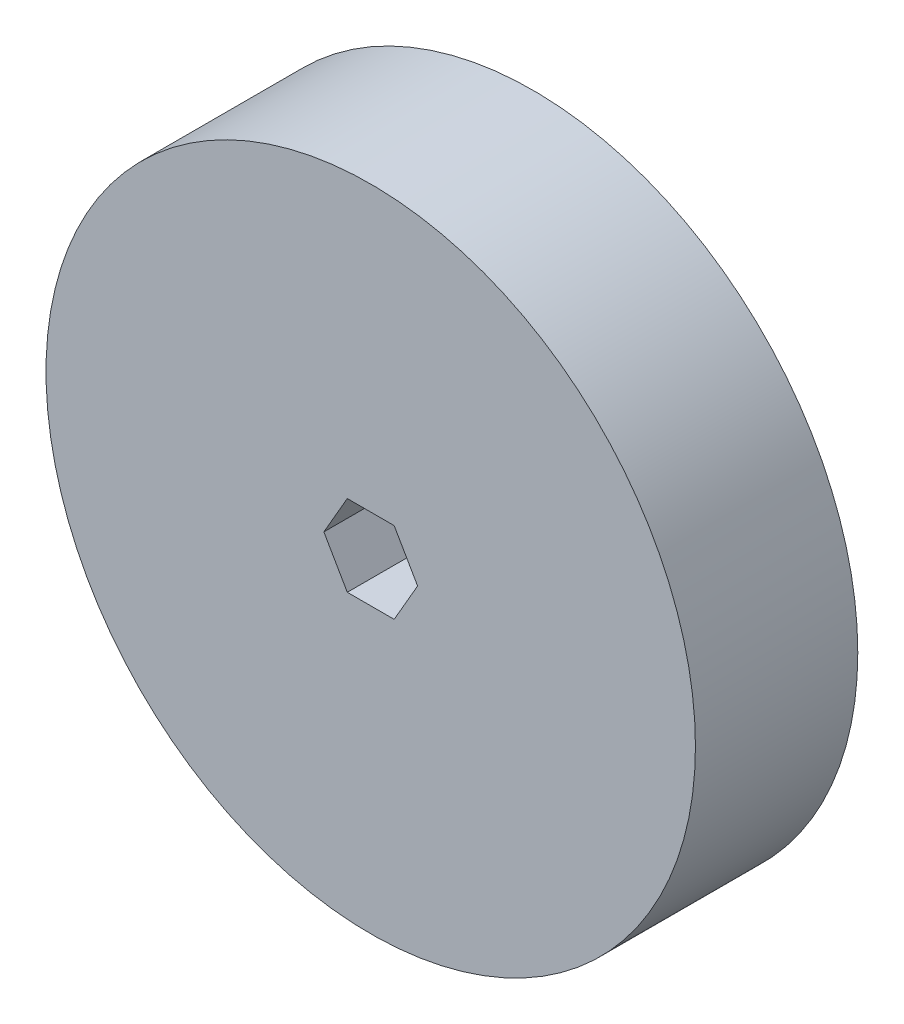
from build123d import *

# Parameters (mm, degrees)
SKETCH1_R           = 50.8
BOSS_EXTRUDE1_DEPTH = 25.4


with BuildPart() as part:
    # Sketch1 → Boss-Extrude1 (new body)
    with BuildSketch(Plane.XY):
        Circle(SKETCH1_R)
        Polygon((-3.666174209, 6.35), (-7.332348419, 0), (-3.666174209, -6.35), (3.666174209, -6.35), (7.332348419, 0), (3.666174209, 6.35), align=None, mode=Mode.SUBTRACT)
    extrude(amount=BOSS_EXTRUDE1_DEPTH)


solid = part.part
